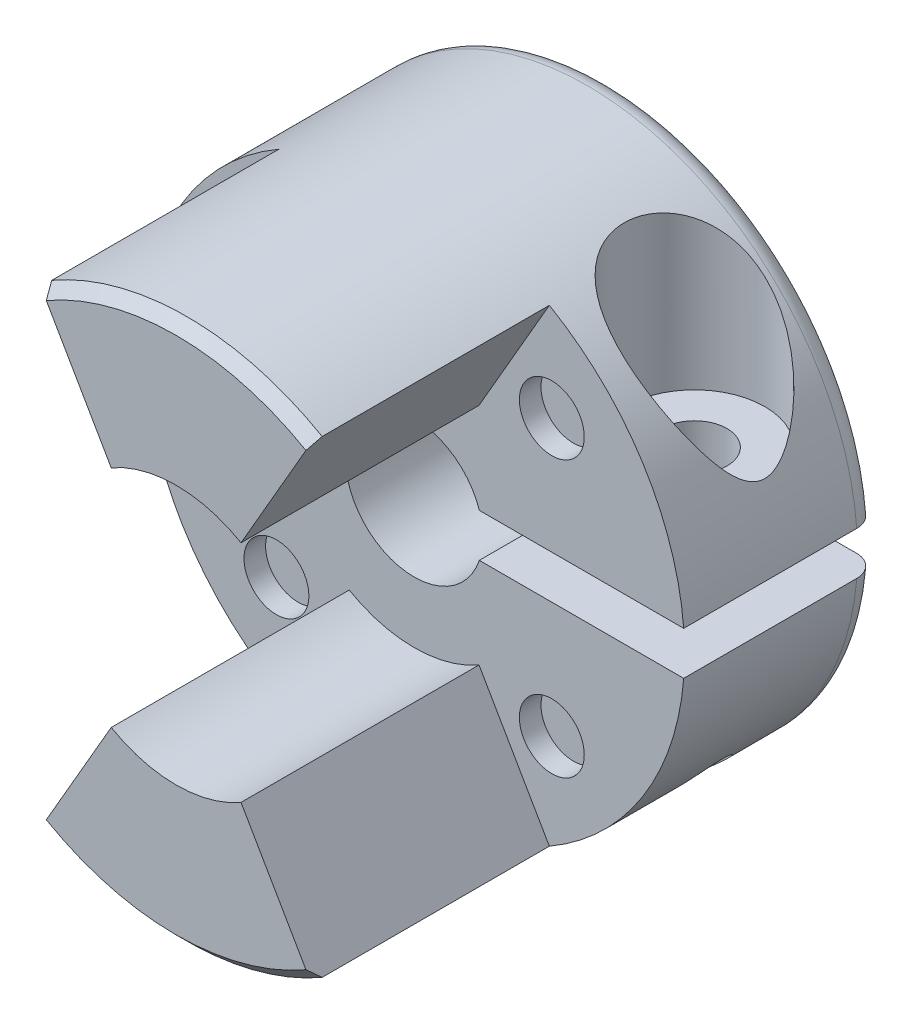
from build123d import *

# Parameters (mm, degrees)
ESBO_O1_R                 = 12.5
RESSALTO_EXTRUS_O1_DEPTH  = 20
CORTE_EXTRUS_O3_START     = -11
CORTE_EXTRUS_O3_DEPTH     = 11
ESBO_O3_R                 = 3.175
CORTE_EXTRUS_O4_DEPTH     = 27.69269563
ESBO_O6_W                 = 12
ESBO_O6_H                 = 2
CORTE_EXTRUS_O5_DEPTH     = 21.820662814
CORTE_EXTRUS_O6_START     = -3
ESBO_O7_R                 = 3.25
CORTE_EXTRUS_O6_DEPTH     = 25.175356483
FURO_ROSCADO_DE_M3X0_51_D = 2.5
FILETE1_R                 = 1
ESBO_O10_R                = 1.5
CORTE_EXTRUS_O7_DEPTH     = 1
CHANFRO1_SIZE             = 0.5
CORTE_EXTRUS_O8_REACH     = 30.784
ESBO_O11_R                = 1.5
ESBO_O12_R                = 6
CORTE_EXTRUS_O9_DEPTH     = 11
PADR_OCIRCULAR1_COUNT     = 4
CHANFRO2_SIZE             = 0.5


with BuildPart() as part:
    # Esboço1 → Ressalto-extrusão1 (new body)
    with BuildSketch(Plane.XY):
        Circle(ESBO_O1_R)
    extrude(amount=RESSALTO_EXTRUS_O1_DEPTH)

    # Esboço2 → Corte-extrusão3 (cut)
    with BuildSketch(Plane.XY.offset(20).offset(CORTE_EXTRUS_O3_START)):
        with BuildLine():
            Line((0, 0), (6.25, 10.825317547))
            ThreePointArc((6.25, 10.825317547), (12.5, 0), (6.25, -10.825317547))
            Line((6.25, -10.825317547), (0, 0))
        make_face()
    corte_extrus_o3 = extrude(amount=CORTE_EXTRUS_O3_DEPTH, mode=Mode.SUBTRACT)

    # Esboço3 → Corte-extrusão4 (cut, through all)
    with BuildSketch(Plane(origin=(0, 0, 0), x_dir=(-1, 0, 0), z_dir=(0, 0, -1))):
        Circle(ESBO_O3_R)
    extrude(amount=-CORTE_EXTRUS_O4_DEPTH, mode=Mode.SUBTRACT)

    # Espelhar1: Corte-extrusão3 across plane
    add(corte_extrus_o3.mirror(Plane(origin=(0, 0, 0), x_dir=(0, 0, 1), z_dir=(1, 0, 0))), mode=Mode.SUBTRACT)

    # Esboço6 → Corte-extrusão5 (cut, through all)
    with BuildSketch(Plane.XY.offset(9)):
        with Locations((7, 0)):
            Rectangle(ESBO_O6_W, ESBO_O6_H)
    extrude(amount=-CORTE_EXTRUS_O5_DEPTH, mode=Mode.SUBTRACT)

    # Esboço7 → Corte-extrusão6 (cut, through all)
    with BuildSketch(Plane.XZ.offset(-1).offset(CORTE_EXTRUS_O6_START)):
        with Locations(Location((8.459935794, 4.5, 0), (0, 0, 270))):
            Circle(ESBO_O7_R)
    extrude(amount=-CORTE_EXTRUS_O6_DEPTH, mode=Mode.SUBTRACT)

    # Furo roscado de M3x0.51 (through all)
    with Locations(Plane(origin=(0, 4, 0), x_dir=(1, 0, 0), z_dir=(0, 1, 0))):
        with Locations((8.459935794, -4.5)):
            Hole(FURO_ROSCADO_DE_M3X0_51_D / 2)

    # Filete1
    filete1_edges = [part.edges().sort_by_distance(p)[0] for p in [
        (-12.5, 0, 0),
    ]]
    fillet(filete1_edges, radius=FILETE1_R)

    # Esboço10 → Corte-extrusão7 (cut)
    with BuildSketch(Plane.XY.offset(9)):
        with Locations((6.363961031, -6.363961031)):
            Circle(ESBO_O10_R)
    corte_extrus_o7 = extrude(amount=-CORTE_EXTRUS_O7_DEPTH, mode=Mode.SUBTRACT)

    # Chanfro1
    chanfro1_edges = [part.edges().sort_by_distance(p)[0] for p in [
        (0, -12.5, 20),
        (0, 12.5, 20),
    ]]
    chamfer(chanfro1_edges, length=CHANFRO1_SIZE)

    # Esboço11 → Corte-extrusão8 (cut, up to next)
    with BuildSketch(Plane(origin=(0, 4, 0), x_dir=(1, 0, 0), z_dir=(0, 1, 0)), mode=Mode.PRIVATE) as corte_extrus_o8_sk1:
        with Locations(Location((8.459935794, -4.5, 0), (0, 0, 270))):
            Circle(ESBO_O11_R)
    corte_extrus_o8_tool1 = extrude(corte_extrus_o8_sk1.sketch, amount=-CORTE_EXTRUS_O8_REACH, mode=Mode.PRIVATE) & part.part
    add(corte_extrus_o8_tool1.solids().sort_by_distance((8.459936, 4, 4.5))[0], mode=Mode.SUBTRACT)

    # Esboço12 → Corte-extrusão9 (cut)
    with BuildSketch(Plane.XY.offset(20)):
        Circle(ESBO_O12_R)
    extrude(amount=-CORTE_EXTRUS_O9_DEPTH, mode=Mode.SUBTRACT)

    # PadrãoCircular1: Corte-extrusão7 ×4 about axis
    padr_ocircular1_axis = Axis((0, 0, 0), (0, 0, 1))
    for i in range(1, PADR_OCIRCULAR1_COUNT):
        add(corte_extrus_o7.rotate(padr_ocircular1_axis, i * 360 / PADR_OCIRCULAR1_COUNT), mode=Mode.SUBTRACT)

    # Chanfro2
    chanfro2_edges = [part.edges().sort_by_distance(p)[0] for p in [
        (-3.175, 0, 0),
    ]]
    chamfer(chanfro2_edges, length=CHANFRO2_SIZE)


solid = part.part
